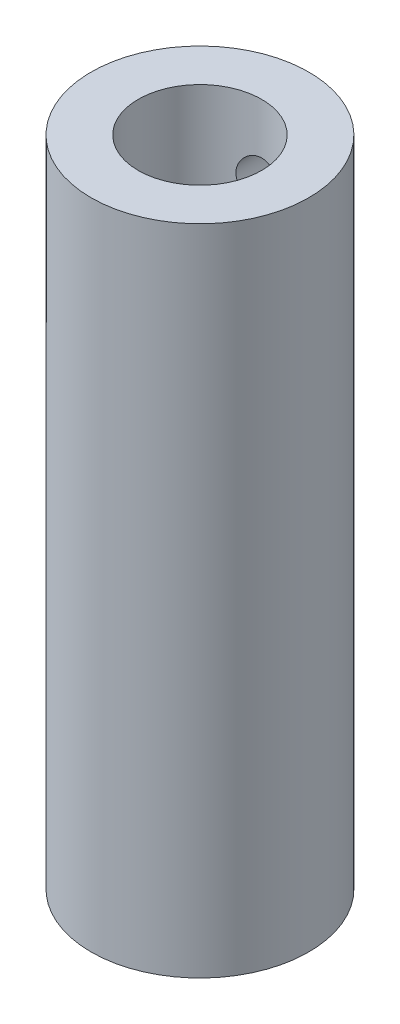
from build123d import *

# Parameters (mm, degrees)
IZIM1_R                     = 7.5
IZIM1_R_2                   = 2.75
Y_KSEKLIK_EKSTR_ZYON1_DEPTH = 15
IZIM2_R                     = 7.5
IZIM2_R_2                   = 4.25
Y_KSEKLIK_EKSTR_ZYON2_DEPTH = 30
IZIM3_R                     = 1.5
KES_EKSTR_ZYON1_DEPTH       = 30


with BuildPart() as part:
    # Çizim1 → Yükseklik-Ekstrüzyon1 (new body)
    with BuildSketch(Plane(origin=(0, 0, 0), x_dir=(1, 0, 0), z_dir=(0, 1, 0))):
        with Locations(Location((0, 0, 0), (0, 0, 270))):
            Circle(IZIM1_R)
        with Locations(Location((0, 0, 0), (0, 0, 270))):
            Circle(IZIM1_R_2, mode=Mode.SUBTRACT)
    extrude(amount=Y_KSEKLIK_EKSTR_ZYON1_DEPTH)

    # Çizim2 → Yükseklik-Ekstrüzyon2 (add)
    with BuildSketch(Plane(origin=(0, 15, 0), x_dir=(1, 0, 0), z_dir=(0, 1, 0))):
        with Locations(Location((0, 0, 0), (0, 0, 270))):
            Circle(IZIM2_R)
        with Locations(Location((0, 0, 0), (0, 0, 270))):
            Circle(IZIM2_R_2, mode=Mode.SUBTRACT)
    extrude(amount=Y_KSEKLIK_EKSTR_ZYON2_DEPTH)

    # Çizim3 → Kes-Ekstrüzyon1 (cut)
    with BuildSketch(Plane.XY):
        with Locations(Location((0, 40, 0), (0, 0, 90))):
            Circle(IZIM3_R)
        with Locations(Location((0, 35, 0), (0, 0, 90))):
            Circle(IZIM3_R)
        with Locations(Location((0, 30, 0), (0, 0, 90))):
            Circle(IZIM3_R)
        with Locations(Location((0, 9, 0), (0, 0, 90))):
            Circle(IZIM3_R)
        with Locations(Location((0, 4, 0), (0, 0, 90))):
            Circle(IZIM3_R)
    extrude(amount=-KES_EKSTR_ZYON1_DEPTH, mode=Mode.SUBTRACT)


solid = part.part
